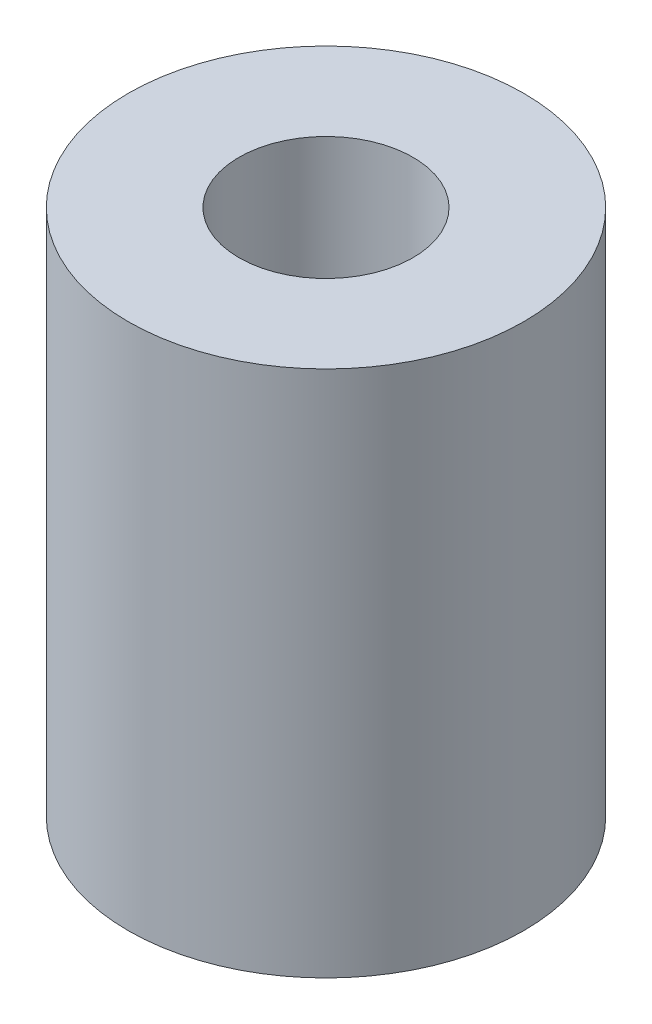
from build123d import *

# Parameters (mm, degrees)
SKETCH1_R           = 4.7625
SKETCH1_R_2         = 2.0955
BOSS_EXTRUDE1_DEPTH = 12.7


with BuildPart() as part:
    # Sketch1 → Boss-Extrude1 (new body)
    with BuildSketch(Plane(origin=(0, 0, 0), x_dir=(1, 0, 0), z_dir=(0, 1, 0))):
        with Locations(Location((0, 0, 0), (0, 0, 270))):
            Circle(SKETCH1_R)
        with Locations(Location((0, 0, 0), (0, 0, 270))):
            Circle(SKETCH1_R_2, mode=Mode.SUBTRACT)
    extrude(amount=BOSS_EXTRUDE1_DEPTH)


solid = part.part
